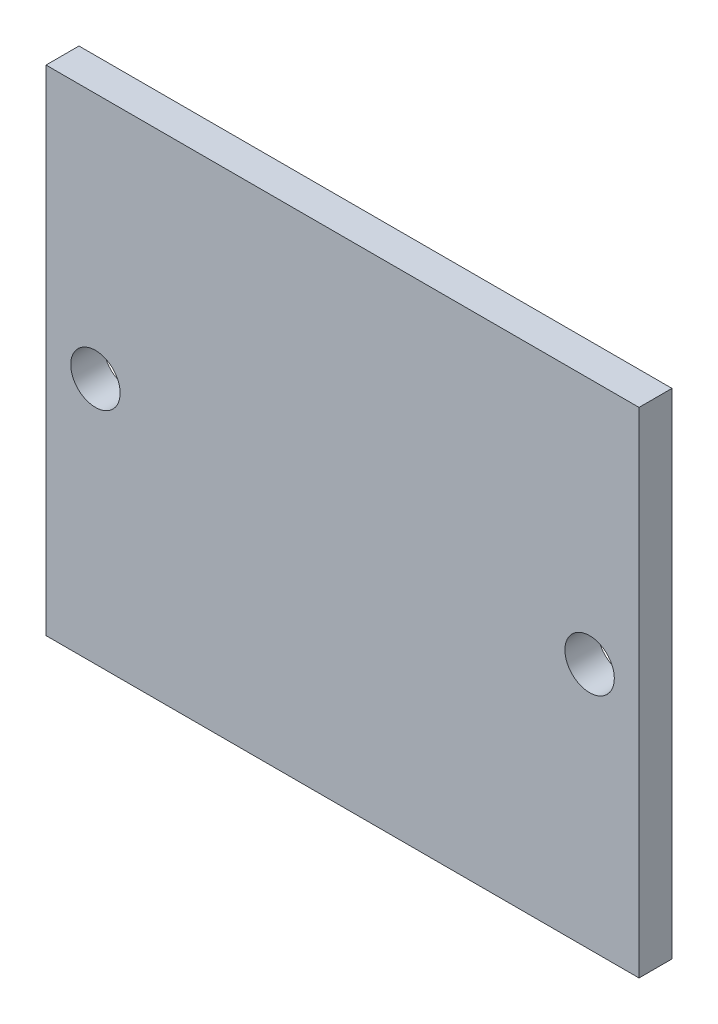
from build123d import *

# Parameters (mm, degrees)
SKETCH_1_W      = 36
SKETCH_1_H      = 30
SKETCH_1_R      = 1.5
EXTRUDE_1_DEPTH = 2


with BuildPart() as part:
    # 草图1 → 凸台-拉伸1 (new body)
    with BuildSketch(Plane.XY):
        Rectangle(SKETCH_1_W, SKETCH_1_H)
        with Locations((-15, 0)):
            Circle(SKETCH_1_R, mode=Mode.SUBTRACT)
        with Locations((15, 0)):
            Circle(SKETCH_1_R, mode=Mode.SUBTRACT)
    extrude(amount=EXTRUDE_1_DEPTH)


solid = part.part
